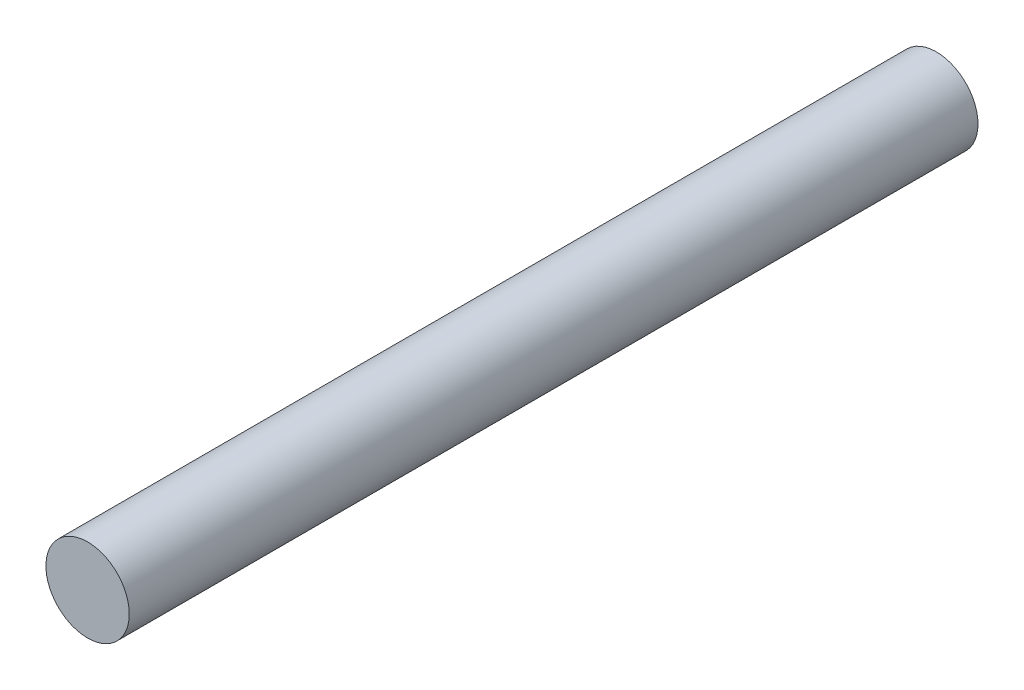
from build123d import *

# Parameters (mm, degrees)
SKETCH1_R           = 5
BOSS_EXTRUDE1_DEPTH = 101.85


with BuildPart() as part:
    # Sketch1 → Boss-Extrude1 (new body)
    with BuildSketch(Plane.XY):
        Circle(SKETCH1_R)
    extrude(amount=BOSS_EXTRUDE1_DEPTH)


solid = part.part
